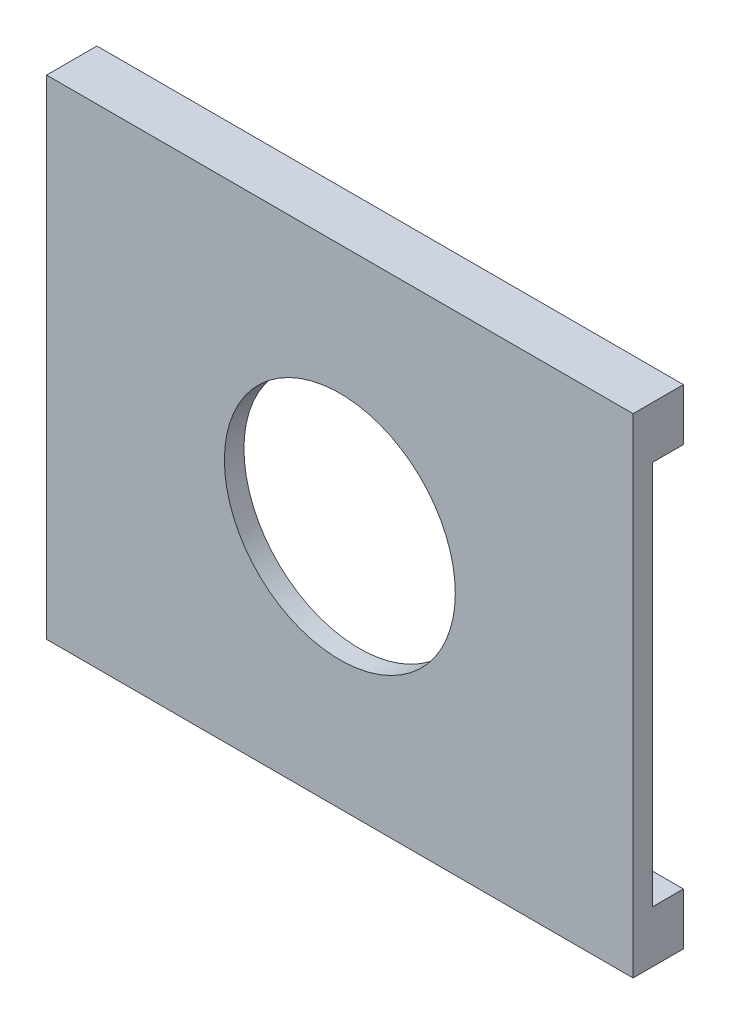
from build123d import *

# Parameters (mm, degrees)
SKETCH1_W           = 76.2
SKETCH1_H           = 63.5
BOSS_EXTRUDE1_DEPTH = 2.54
SKETCH2_W           = 76.2
SKETCH2_H           = 6.75
BOSS_EXTRUDE2_DEPTH = 4
SKETCH3_R           = 2.032
CUT_EXTRUDE1_DEPTH  = 3.81
SKETCH4_R           = 15
CUT_EXTRUDE2_DEPTH  = 10


with BuildPart() as part:
    # Sketch1 → Boss-Extrude1 (new body)
    with BuildSketch(Plane.XY):
        with Locations((38.1, 31.75)):
            Rectangle(SKETCH1_W, SKETCH1_H)
    extrude(amount=BOSS_EXTRUDE1_DEPTH)

    # Sketch2 → Boss-Extrude2 (add)
    with BuildSketch(Plane(origin=(0, 0, 0), x_dir=(-1, 0, 0), z_dir=(0, 0, -1))):
        with Locations((-38.1, 60.125)):
            Rectangle(SKETCH2_W, SKETCH2_H)
        with Locations((-38.1, 3.375)):
            Rectangle(SKETCH2_W, SKETCH2_H)
    extrude(amount=BOSS_EXTRUDE2_DEPTH)

    # Sketch3 → Cut-Extrude1 (cut)
    with BuildSketch(Plane(origin=(0, 0, -4), x_dir=(-1, 0, 0), z_dir=(0, 0, -1))):
        with Locations((-63.5, 60.125)):
            Circle(SKETCH3_R)
        with Locations((-63.5, 3.375)):
            Circle(SKETCH3_R)
        with Locations((-12.7, 3.375)):
            Circle(SKETCH3_R)
        with Locations((-12.7, 60.125)):
            Circle(SKETCH3_R)
    extrude(amount=-CUT_EXTRUDE1_DEPTH, mode=Mode.SUBTRACT)

    # Sketch4 → Cut-Extrude2 (cut)
    with BuildSketch(Plane.XY.offset(2.54)):
        with Locations((38.1, 31.75)):
            Circle(SKETCH4_R)
    extrude(amount=-CUT_EXTRUDE2_DEPTH, mode=Mode.SUBTRACT)


solid = part.part
